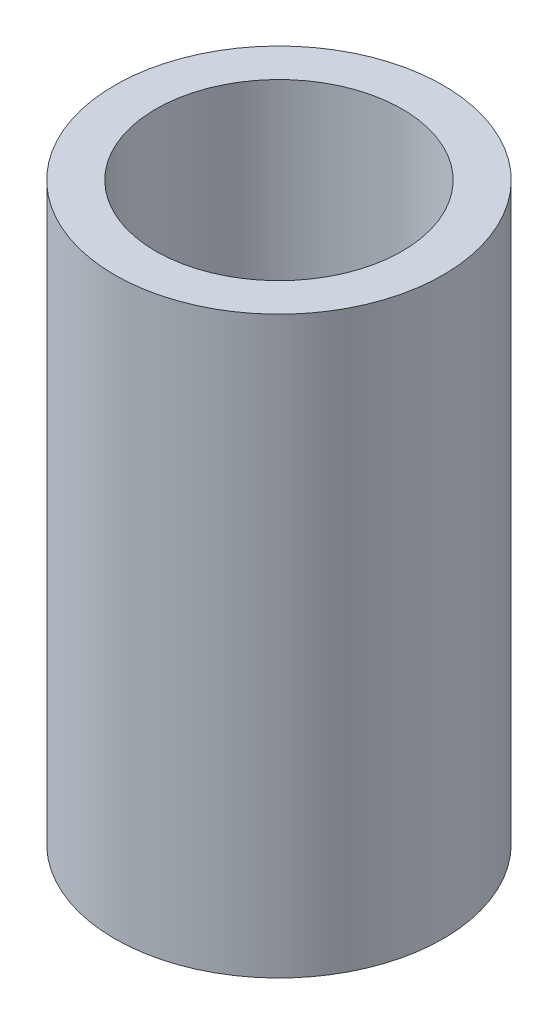
from build123d import *

# Parameters (mm, degrees)
SKETCH2_R           = 8
SKETCH2_R_2         = 6
BOSS_EXTRUDE1_DEPTH = 14


with BuildPart() as part:
    # Sketch2 → Boss-Extrude1 (new, symmetric)
    with BuildSketch(Plane(origin=(0, 0, 0), x_dir=(1, 0, 0), z_dir=(0, 1, 0))):
        with Locations(Location((0, 0, 0), (0, 0, 270))):
            Circle(SKETCH2_R)
        with Locations(Location((0, 0, 0), (0, 0, 270))):
            Circle(SKETCH2_R_2, mode=Mode.SUBTRACT)
    extrude(amount=BOSS_EXTRUDE1_DEPTH, both=True)


solid = part.part
